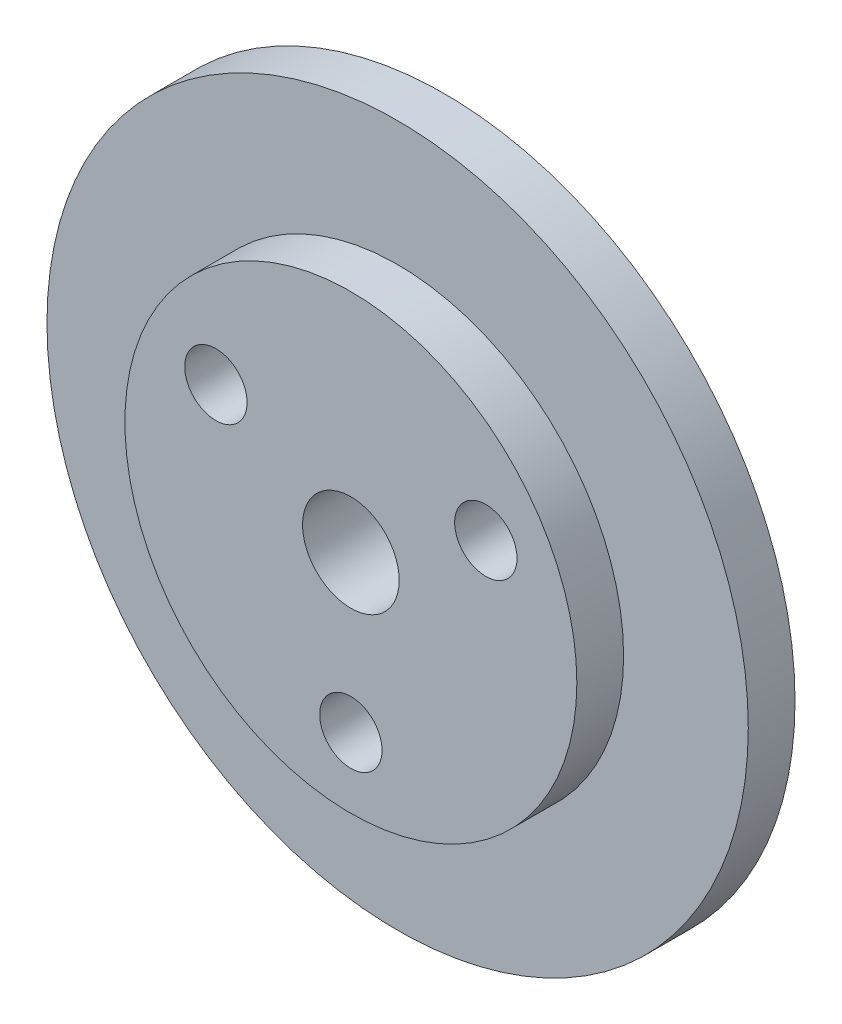
from build123d import *

# Parameters (mm, degrees)
ESQUISSE1_R             = 22.5
BOSS_EXTRU_1_DEPTH      = 3
ESQUISSE2_R             = 14.5
BOSS_EXTRU_2_DEPTH      = 3
ESQUISSE3_R             = 2
ESQUISSE3_R_2           = 3.1
ENL_V_MAT_EXTRU_1_DEPTH = 33.380549717


with BuildPart() as part:
    # Esquisse1 → Boss.-Extru.1 (new body)
    with BuildSketch(Plane.XY):
        Circle(ESQUISSE1_R)
    extrude(amount=BOSS_EXTRU_1_DEPTH)

    # Esquisse2 → Boss.-Extru.2 (add)
    with BuildSketch(Plane.XY.offset(3)):
        Circle(ESQUISSE2_R)
    extrude(amount=BOSS_EXTRU_2_DEPTH)

    # Esquisse3 → Enlèv. mat.-Extru.1 (cut, through all)
    with BuildSketch(Plane.XY.offset(6)):
        with Locations((8.660254038, 5)):
            Circle(ESQUISSE3_R)
        with Locations((-8.660254038, 5)):
            Circle(ESQUISSE3_R)
        with Locations((0, -10)):
            Circle(ESQUISSE3_R)
        Circle(ESQUISSE3_R_2)
    extrude(amount=-ENL_V_MAT_EXTRU_1_DEPTH, mode=Mode.SUBTRACT)


solid = part.part
